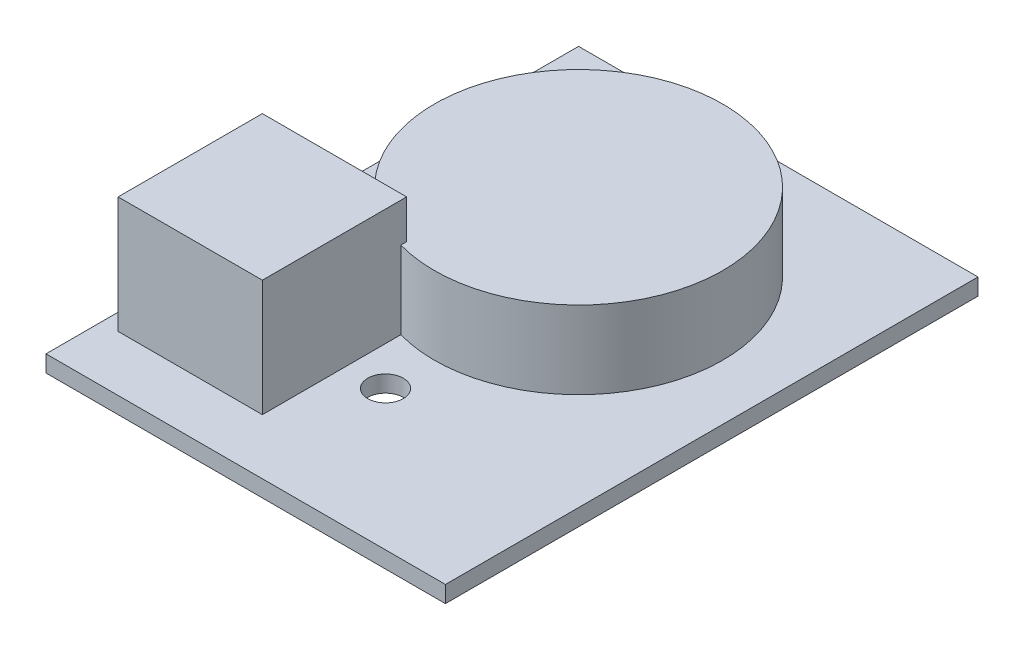
from build123d import *

# Parameters (mm, degrees)
SKETCH1_W           = 36
SKETCH1_H           = 48
BOSS_EXTRUDE1_DEPTH = 1.5
SKETCH1_3_R         = 13
BOSS_EXTRUDE2_DEPTH = 8.5
SKETCH1_4_W         = 13
SKETCH1_4_H         = 13
BOSS_EXTRUDE3_DEPTH = 12
SKETCH1_5_R         = 1.6
CUT_EXTRUDE2_DEPTH  = 33.310988843


with BuildPart() as part:
    # Sketch1 → Boss-Extrude1 (new body)
    with BuildSketch(Plane(origin=(0, 0, 0), x_dir=(1, 0, 0), z_dir=(0, 1, 0))):
        Rectangle(SKETCH1_W, SKETCH1_H)
    extrude(amount=BOSS_EXTRUDE1_DEPTH)

    # Sketch1<3> → Boss-Extrude2 (add)
    with BuildSketch(Plane(origin=(0, 0, 0), x_dir=(1, 0, 0), z_dir=(0, 1, 0))):
        with Locations((0, 6)):
            Circle(SKETCH1_3_R)
    extrude(amount=BOSS_EXTRUDE2_DEPTH)

    # Sketch1<4> → Boss-Extrude3 (add)
    with BuildSketch(Plane(origin=(0, 0, 0), x_dir=(1, 0, 0), z_dir=(0, 1, 0))):
        with Locations((-10, -12.5)):
            Rectangle(SKETCH1_4_W, SKETCH1_4_H)
    extrude(amount=BOSS_EXTRUDE3_DEPTH)

    # Sketch1<5> → Cut-Extrude2 (cut, through all)
    with BuildSketch(Plane(origin=(0, 0, 0), x_dir=(1, 0, 0), z_dir=(0, 1, 0))):
        with Locations((0, -11.4)):
            Circle(SKETCH1_5_R)
    extrude(amount=CUT_EXTRUDE2_DEPTH, mode=Mode.SUBTRACT)


solid = part.part
